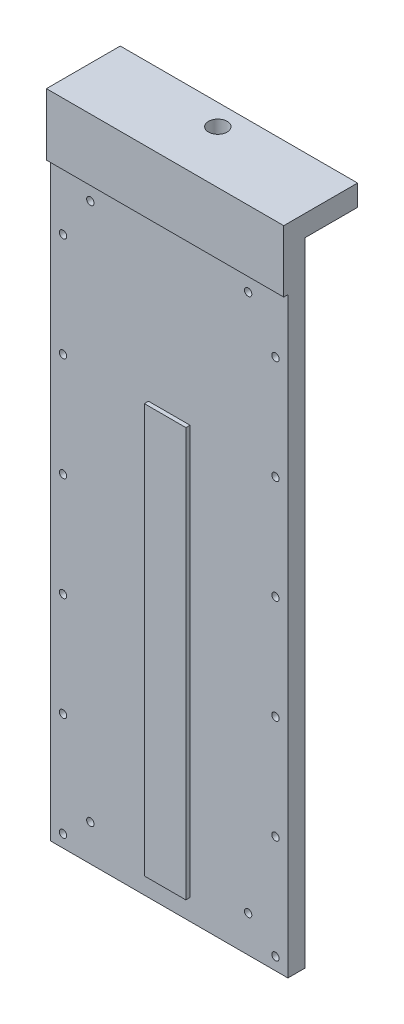
from build123d import *

# Parameters (mm, degrees)
SKETCH1_W                 = 57.15
SKETCH1_H                 = 5.08
BOSS_EXTRUDE1_DEPTH       = 152.4
CUT_EXTRUDE1_DEPTH        = 1
SKETCH3_W                 = 57.15
SKETCH3_H                 = 5.08
BOSS_EXTRUDE2_DEPTH       = 12.7
SKETCH4_R                 = 2.25
CUT_EXTRUDE2_DEPTH        = 12.7
SKETCH5_R                 = 0.889
CUT_EXTRUDE3_DEPTH        = 156.961081764
SKETCH6_W                 = 57.15
SKETCH6_H                 = 4.08
BOSS_EXTRUDE3_DEPTH       = 5
SKETCH7_R                 = 0.889
CUT_EXTRUDE4_DEPTH        = 161.850424386
LPATTERN1_COUNT           = 6
LPATTERN1_PITCH           = 25
LPATTERN1_COPY_1_SKETCH_R = 0.889
LPATTERN1_COPY_1_DEPTH    = 161.850424386
LPATTERN1_COPY_2_SKETCH_R = 0.889
LPATTERN1_COPY_2_DEPTH    = 161.850424386
LPATTERN1_COPY_3_SKETCH_R = 0.889
LPATTERN1_COPY_3_DEPTH    = 161.850424386
LPATTERN1_COPY_4_SKETCH_R = 0.889
LPATTERN1_COPY_4_DEPTH    = 161.850424386
LPATTERN1_COPY_5_SKETCH_R = 0.889
LPATTERN1_COPY_5_DEPTH    = 161.850424386


with BuildPart() as part:
    # Sketch1 → Boss-Extrude1 (new body)
    with BuildSketch(Plane(origin=(0, 0, 0), x_dir=(1, 0, 0), z_dir=(0, 1, 0))):
        Rectangle(SKETCH1_W, SKETCH1_H)
    extrude(amount=-BOSS_EXTRUDE1_DEPTH)

    # Sketch2 → Cut-Extrude1 (cut)
    with BuildSketch(Plane.XY.offset(2.54)):
        Polygon((-5, -152.4), (-5, -53.9), (5, -53.9), (5, -152.4), (28.575, -152.4), (28.575, -14.9), (-28.575, -14.9), (-28.575, -152.4), align=None)
    extrude(amount=-CUT_EXTRUDE1_DEPTH, mode=Mode.SUBTRACT)

    # Sketch3 → Boss-Extrude2 (add)
    with BuildSketch(Plane(origin=(0, 0, -2.54), x_dir=(-1, 0, 0), z_dir=(0, 0, -1))):
        with Locations((0, -2.54)):
            Rectangle(SKETCH3_W, SKETCH3_H)
    extrude(amount=BOSS_EXTRUDE2_DEPTH)

    # Sketch4 → Cut-Extrude2 (cut)
    with BuildSketch(Plane(origin=(0, 0, 0), x_dir=(1, 0, 0), z_dir=(0, 1, 0))):
        with Locations(Location((0, 10.16, 0), (0, 0, 270))):
            Circle(SKETCH4_R)
    extrude(amount=-CUT_EXTRUDE2_DEPTH, mode=Mode.SUBTRACT)

    # Sketch5 → Cut-Extrude3 (cut, through all)
    with BuildSketch(Plane.XY.offset(1.54)):
        with Locations((-19, -19.15)):
            Circle(SKETCH5_R)
        with Locations((19, -19.15)):
            Circle(SKETCH5_R)
        with Locations((-19, -148.65)):
            Circle(SKETCH5_R)
        with Locations((19, -148.65)):
            Circle(SKETCH5_R)
    extrude(amount=-CUT_EXTRUDE3_DEPTH, mode=Mode.SUBTRACT)

    # Sketch6 → Boss-Extrude3 (add)
    with BuildSketch(Plane.XZ.offset(152.4)):
        with Locations((0, -0.5)):
            Rectangle(SKETCH6_W, SKETCH6_H)
    extrude(amount=BOSS_EXTRUDE3_DEPTH)

    # Sketch7 → Cut-Extrude4 (cut, through all)
    with BuildSketch(Plane.XY.offset(1.54)):
        with Locations((-25.575, -154.4)):
            Circle(SKETCH7_R)
    cut_extrude4 = extrude(amount=-CUT_EXTRUDE4_DEPTH, mode=Mode.SUBTRACT)

    # Mirror1: Cut-Extrude4 across plane
    add(cut_extrude4.mirror(Plane(origin=(0, 0, 0), x_dir=(0, 0, 1), z_dir=(1, 0, 0))), mode=Mode.SUBTRACT)

    # LPattern1: Cut-Extrude4 ×6
    with Locations(*[(0, i * LPATTERN1_PITCH, 0) for i in range(1, LPATTERN1_COUNT)]):
        add(cut_extrude4, mode=Mode.SUBTRACT)

    # LPattern1 copy 1 sketch → LPattern1 copy 1 (cut, through all)
    with BuildSketch(Plane(origin=(0, 25, 1.54), x_dir=(-1, 0, 0), z_dir=(0, 0, 1))):
        with Locations((-25.575, 154.4)):
            Circle(LPATTERN1_COPY_1_SKETCH_R)
    extrude(amount=-LPATTERN1_COPY_1_DEPTH, mode=Mode.SUBTRACT)

    # LPattern1 copy 2 sketch → LPattern1 copy 2 (cut, through all)
    with BuildSketch(Plane(origin=(0, 50, 1.54), x_dir=(-1, 0, 0), z_dir=(0, 0, 1))):
        with Locations((-25.575, 154.4)):
            Circle(LPATTERN1_COPY_2_SKETCH_R)
    extrude(amount=-LPATTERN1_COPY_2_DEPTH, mode=Mode.SUBTRACT)

    # LPattern1 copy 3 sketch → LPattern1 copy 3 (cut, through all)
    with BuildSketch(Plane(origin=(0, 75, 1.54), x_dir=(-1, 0, 0), z_dir=(0, 0, 1))):
        with Locations((-25.575, 154.4)):
            Circle(LPATTERN1_COPY_3_SKETCH_R)
    extrude(amount=-LPATTERN1_COPY_3_DEPTH, mode=Mode.SUBTRACT)

    # LPattern1 copy 4 sketch → LPattern1 copy 4 (cut, through all)
    with BuildSketch(Plane(origin=(0, 100, 1.54), x_dir=(-1, 0, 0), z_dir=(0, 0, 1))):
        with Locations((-25.575, 154.4)):
            Circle(LPATTERN1_COPY_4_SKETCH_R)
    extrude(amount=-LPATTERN1_COPY_4_DEPTH, mode=Mode.SUBTRACT)

    # LPattern1 copy 5 sketch → LPattern1 copy 5 (cut, through all)
    with BuildSketch(Plane(origin=(0, 125, 1.54), x_dir=(-1, 0, 0), z_dir=(0, 0, 1))):
        with Locations((-25.575, 154.4)):
            Circle(LPATTERN1_COPY_5_SKETCH_R)
    extrude(amount=-LPATTERN1_COPY_5_DEPTH, mode=Mode.SUBTRACT)


solid = part.part
